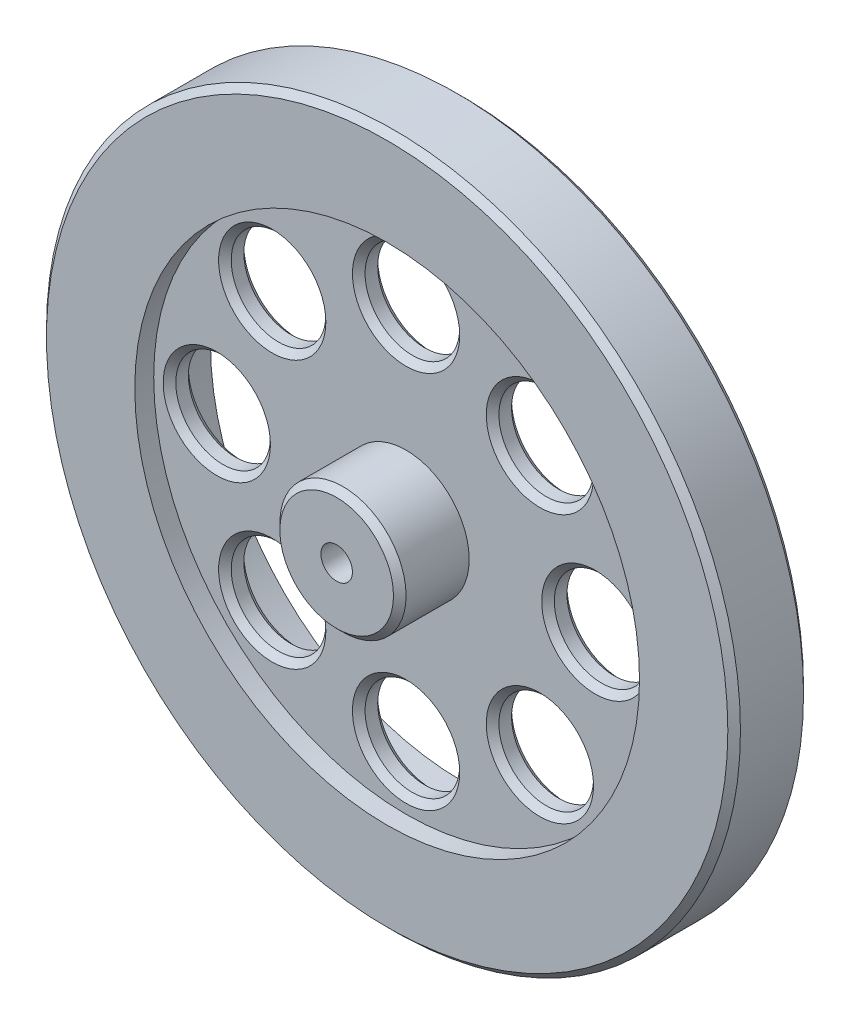
from build123d import *

# Parameters (mm, degrees)
SKETCH1_R           = 55
BOSS_EXTRUDE1_DEPTH = 12
SKETCH2_R           = 40
CUT_EXTRUDE1_DEPTH  = 5
CUT_EXTRUDE2_START  = -3
SKETCH3_R           = 40
CUT_EXTRUDE2_DEPTH  = 3
SKETCH4_R           = 10
BOSS_EXTRUDE2_DEPTH = 11
SKETCH5_R           = 2.5
CUT_EXTRUDE3_DEPTH  = 81.311892021
SKETCH6_R           = 7.5
CUT_EXTRUDE4_DEPTH  = 79.555712714
CHAMFER1_SIZE       = 1


with BuildPart() as part:
    # Sketch1 → Boss-Extrude1 (new body)
    with BuildSketch(Plane.XY):
        Circle(SKETCH1_R)
    extrude(amount=BOSS_EXTRUDE1_DEPTH)

    # Sketch2 → Cut-Extrude1 (cut)
    with BuildSketch(Plane(origin=(0, 0, 0), x_dir=(-1, 0, 0), z_dir=(0, 0, -1))):
        Circle(SKETCH2_R)
    extrude(amount=-CUT_EXTRUDE1_DEPTH, mode=Mode.SUBTRACT)

    # Sketch3 → Cut-Extrude2 (cut)
    with BuildSketch(Plane.XY.offset(12).offset(CUT_EXTRUDE2_START)):
        with Locations(Location((0, 0, 0), (0, 0, 180))):
            Circle(SKETCH3_R)
    extrude(amount=CUT_EXTRUDE2_DEPTH, mode=Mode.SUBTRACT)

    # Sketch4 → Boss-Extrude2 (add)
    with BuildSketch(Plane.XY.offset(9)):
        Circle(SKETCH4_R)
    extrude(amount=BOSS_EXTRUDE2_DEPTH)

    # Sketch5 → Cut-Extrude3 (cut, through all)
    with BuildSketch(Plane.XY.offset(20)):
        Circle(SKETCH5_R)
    extrude(amount=-CUT_EXTRUDE3_DEPTH, mode=Mode.SUBTRACT)

    # Sketch6 → Cut-Extrude4 (cut, through all)
    with BuildSketch(Plane.XY.offset(9)):
        with Locations((0, 30)):
            Circle(SKETCH6_R)
        with Locations((21.213203436, 21.213203436)):
            Circle(SKETCH6_R)
        with Locations((30, 0)):
            Circle(SKETCH6_R)
        with Locations((21.213203436, -21.213203436)):
            Circle(SKETCH6_R)
        with Locations((0, -30)):
            Circle(SKETCH6_R)
        with Locations((-21.213203436, -21.213203436)):
            Circle(SKETCH6_R)
        with Locations((-30, 0)):
            Circle(SKETCH6_R)
        with Locations((-21.213203436, 21.213203436)):
            Circle(SKETCH6_R)
    extrude(amount=-CUT_EXTRUDE4_DEPTH, mode=Mode.SUBTRACT)

    # Chamfer1
    chamfer1_edges = [part.edges().sort_by_distance(p)[0] for p in [
        (-10, 0, 20),
        (-55, 0, 0),
        (-28.713203436, 21.213203436, 5),
        (-28.713203436, 21.213203436, 9),
        (-37.5, 0, 5),
        (-37.5, 0, 9),
        (-28.713203436, -21.213203436, 5),
        (-28.713203436, -21.213203436, 9),
        (-7.5, -30, 5),
        (-7.5, -30, 9),
        (13.713203436, -21.213203436, 5),
        (13.713203436, -21.213203436, 9),
        (22.5, 0, 5),
        (22.5, 0, 9),
        (13.713203436, 21.213203436, 5),
        (13.713203436, 21.213203436, 9),
        (-7.5, 30, 5),
        (-7.5, 30, 9),
        (-55, 0, 12),
    ]]
    chamfer(chamfer1_edges, length=CHAMFER1_SIZE)


solid = part.part
